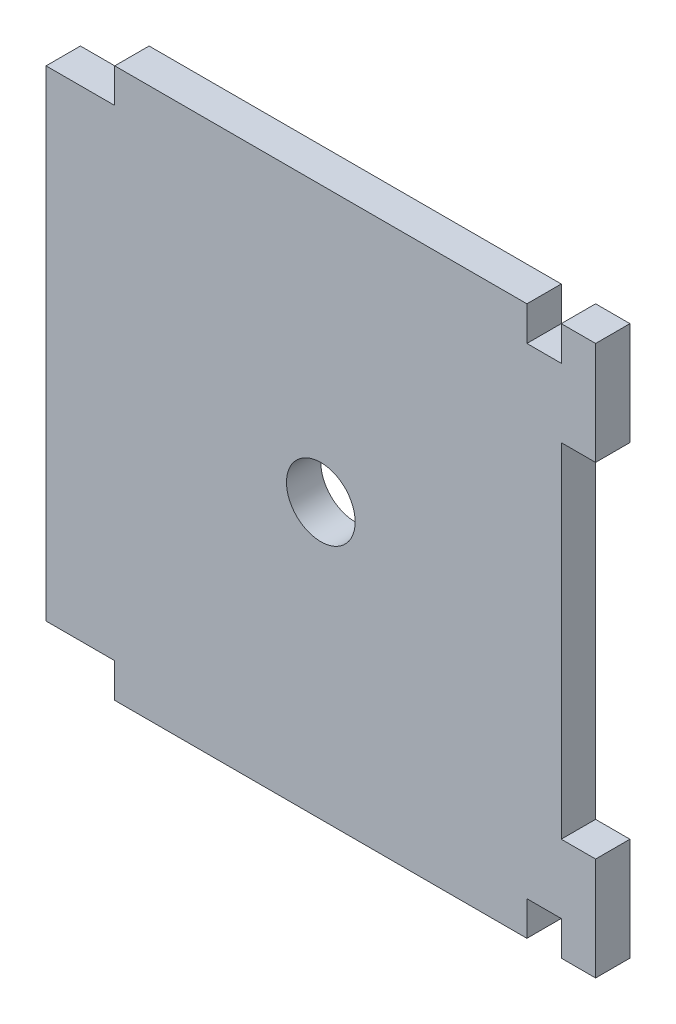
from build123d import *

# Parameters (mm, degrees)
ESQUISSE1_W        = 80
ESQUISSE1_H        = 80
ESQUISSE1_R        = 5
BOSS_EXTRU_1_DEPTH = 5
ESQUISSE2_W        = 10
ESQUISSE2_H        = 5
ESQUISSE2_W_2      = 5
ESQUISSE2_H_2      = 50
CR_NEAUX_DEPTH     = 5


with BuildPart() as part:
    # Esquisse1 → Boss.-Extru.1 (new body)
    with BuildSketch(Plane.XY):
        with Locations((40, 40)):
            Rectangle(ESQUISSE1_W, ESQUISSE1_H)
        with Locations((40, 40)):
            Circle(ESQUISSE1_R, mode=Mode.SUBTRACT)
    extrude(amount=BOSS_EXTRU_1_DEPTH)

    # Esquisse2 → Créneaux - (cut)
    with BuildSketch(Plane.XY.offset(5)):
        with Locations((5, 2.5)):
            Rectangle(ESQUISSE2_W, ESQUISSE2_H)
        with Locations((5, 77.5)):
            Rectangle(ESQUISSE2_W, ESQUISSE2_H)
        with Locations((77.5, 40)):
            Rectangle(ESQUISSE2_W_2, ESQUISSE2_H_2)
        with Locations((72.5, 77.5)):
            Rectangle(ESQUISSE2_W_2, ESQUISSE2_H)
        with Locations((72.5, 2.5)):
            Rectangle(ESQUISSE2_W_2, ESQUISSE2_H)
    extrude(amount=-CR_NEAUX_DEPTH, mode=Mode.SUBTRACT)


solid = part.part
